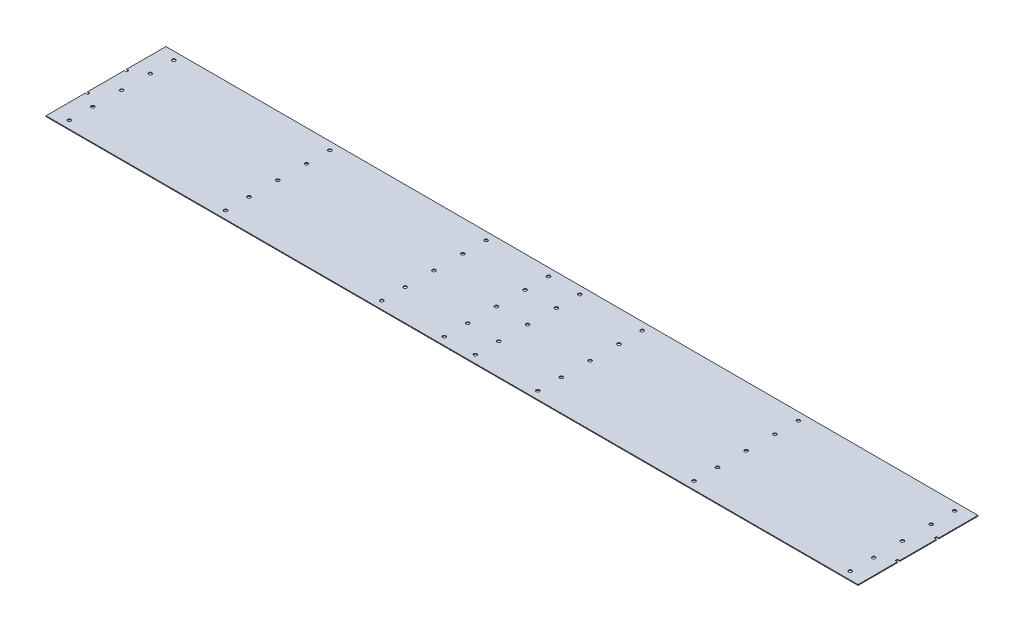
from build123d import *

# Parameters (mm, degrees)
SKETCH1_R           = 2.15
BOSS_EXTRUDE1_DEPTH = 1


with BuildPart() as part:
    # Sketch1 → Boss-Extrude1 (new body)
    with BuildSketch(Plane(origin=(0, 0, 0), x_dir=(1, 0, 0), z_dir=(0, 1, 0))):
        Polygon((-20, -26.5), (-20, -76.8), (1020, -76.8), (1020, -26.5), (1017, -26.5), (1017, -23.5), (1020, -23.5), (1020, 23.5), (1017, 23.5), (1017, 26.5), (1020, 26.5), (1020, 76.8), (-20, 76.8), (-20, 26.5), (-17, 26.5), (-17, 23.5), (-20, 23.5), (-20, -23.5), (-17, -23.5), (-17, -26.5), align=None)
        with Locations(Location((0, -36.8, 0), (0, 0, 270))):
            Circle(SKETCH1_R, mode=Mode.SUBTRACT)
        with Locations(Location((0, 36.8, 0), (0, 0, 270))):
            Circle(SKETCH1_R, mode=Mode.SUBTRACT)
        with Locations(Location((0, -66.8, 0), (0, 0, 270))):
            Circle(SKETCH1_R, mode=Mode.SUBTRACT)
        with Locations(Location((0, 66.8, 0), (0, 0, 270))):
            Circle(SKETCH1_R, mode=Mode.SUBTRACT)
        with Locations(Location((200, -66.8, 0), (0, 0, 270))):
            Circle(SKETCH1_R, mode=Mode.SUBTRACT)
        with Locations(Location((200, -36.8, 0), (0, 0, 270))):
            Circle(SKETCH1_R, mode=Mode.SUBTRACT)
        with Locations(Location((200, 36.8, 0), (0, 0, 270))):
            Circle(SKETCH1_R, mode=Mode.SUBTRACT)
        with Locations(Location((200, 66.8, 0), (0, 0, 270))):
            Circle(SKETCH1_R, mode=Mode.SUBTRACT)
        with Locations(Location((0, 0, 0), (0, 0, 270))):
            Circle(SKETCH1_R, mode=Mode.SUBTRACT)
        with Locations(Location((480, 0, 0), (0, 0, 270))):
            Circle(SKETCH1_R, mode=Mode.SUBTRACT)
        with Locations(Location((200, 0, 0), (0, 0, 270))):
            Circle(SKETCH1_R, mode=Mode.SUBTRACT)
        with Locations(Location((480, 66.8, 0), (0, 0, 270))):
            Circle(SKETCH1_R, mode=Mode.SUBTRACT)
        with Locations(Location((480, 36.8, 0), (0, 0, 270))):
            Circle(SKETCH1_R, mode=Mode.SUBTRACT)
        with Locations(Location((480, -36.8, 0), (0, 0, 270))):
            Circle(SKETCH1_R, mode=Mode.SUBTRACT)
        with Locations(Location((480, -66.8, 0), (0, 0, 270))):
            Circle(SKETCH1_R, mode=Mode.SUBTRACT)
        with Locations(Location((400, -66.8, 0), (0, 0, 270))):
            Circle(SKETCH1_R, mode=Mode.SUBTRACT)
        with Locations(Location((400, -36.8, 0), (0, 0, 270))):
            Circle(SKETCH1_R, mode=Mode.SUBTRACT)
        with Locations(Location((400, 36.8, 0), (0, 0, 270))):
            Circle(SKETCH1_R, mode=Mode.SUBTRACT)
        with Locations(Location((400, 66.8, 0), (0, 0, 270))):
            Circle(SKETCH1_R, mode=Mode.SUBTRACT)
        with Locations(Location((600, -66.8, 0), (0, 0, 270))):
            Circle(SKETCH1_R, mode=Mode.SUBTRACT)
        with Locations(Location((600, -36.8, 0), (0, 0, 270))):
            Circle(SKETCH1_R, mode=Mode.SUBTRACT)
        with Locations(Location((600, 36.8, 0), (0, 0, 270))):
            Circle(SKETCH1_R, mode=Mode.SUBTRACT)
        with Locations(Location((600, 66.8, 0), (0, 0, 270))):
            Circle(SKETCH1_R, mode=Mode.SUBTRACT)
        with Locations(Location((800, -66.8, 0), (0, 0, 270))):
            Circle(SKETCH1_R, mode=Mode.SUBTRACT)
        with Locations(Location((800, -36.8, 0), (0, 0, 270))):
            Circle(SKETCH1_R, mode=Mode.SUBTRACT)
        with Locations(Location((800, 36.8, 0), (0, 0, 270))):
            Circle(SKETCH1_R, mode=Mode.SUBTRACT)
        with Locations(Location((800, 66.8, 0), (0, 0, 270))):
            Circle(SKETCH1_R, mode=Mode.SUBTRACT)
        with Locations(Location((1000, -66.8, 0), (0, 0, 270))):
            Circle(SKETCH1_R, mode=Mode.SUBTRACT)
        with Locations(Location((1000, -36.8, 0), (0, 0, 270))):
            Circle(SKETCH1_R, mode=Mode.SUBTRACT)
        with Locations(Location((1000, 36.8, 0), (0, 0, 270))):
            Circle(SKETCH1_R, mode=Mode.SUBTRACT)
        with Locations(Location((1000, 66.8, 0), (0, 0, 270))):
            Circle(SKETCH1_R, mode=Mode.SUBTRACT)
        with Locations(Location((520, -66.8, 0), (0, 0, 270))):
            Circle(SKETCH1_R, mode=Mode.SUBTRACT)
        with Locations(Location((520, -36.8, 0), (0, 0, 270))):
            Circle(SKETCH1_R, mode=Mode.SUBTRACT)
        with Locations(Location((520, 0, 0), (0, 0, 270))):
            Circle(SKETCH1_R, mode=Mode.SUBTRACT)
        with Locations(Location((520, 36.8, 0), (0, 0, 270))):
            Circle(SKETCH1_R, mode=Mode.SUBTRACT)
        with Locations(Location((520, 66.8, 0), (0, 0, 270))):
            Circle(SKETCH1_R, mode=Mode.SUBTRACT)
        with Locations(Location((600, 0, 0), (0, 0, 270))):
            Circle(SKETCH1_R, mode=Mode.SUBTRACT)
        with Locations(Location((800, 0, 0), (0, 0, 270))):
            Circle(SKETCH1_R, mode=Mode.SUBTRACT)
        with Locations(Location((1000, 0, 0), (0, 0, 270))):
            Circle(SKETCH1_R, mode=Mode.SUBTRACT)
        with Locations(Location((400, 0, 0), (0, 0, 270))):
            Circle(SKETCH1_R, mode=Mode.SUBTRACT)
    extrude(amount=BOSS_EXTRUDE1_DEPTH)


solid = part.part
